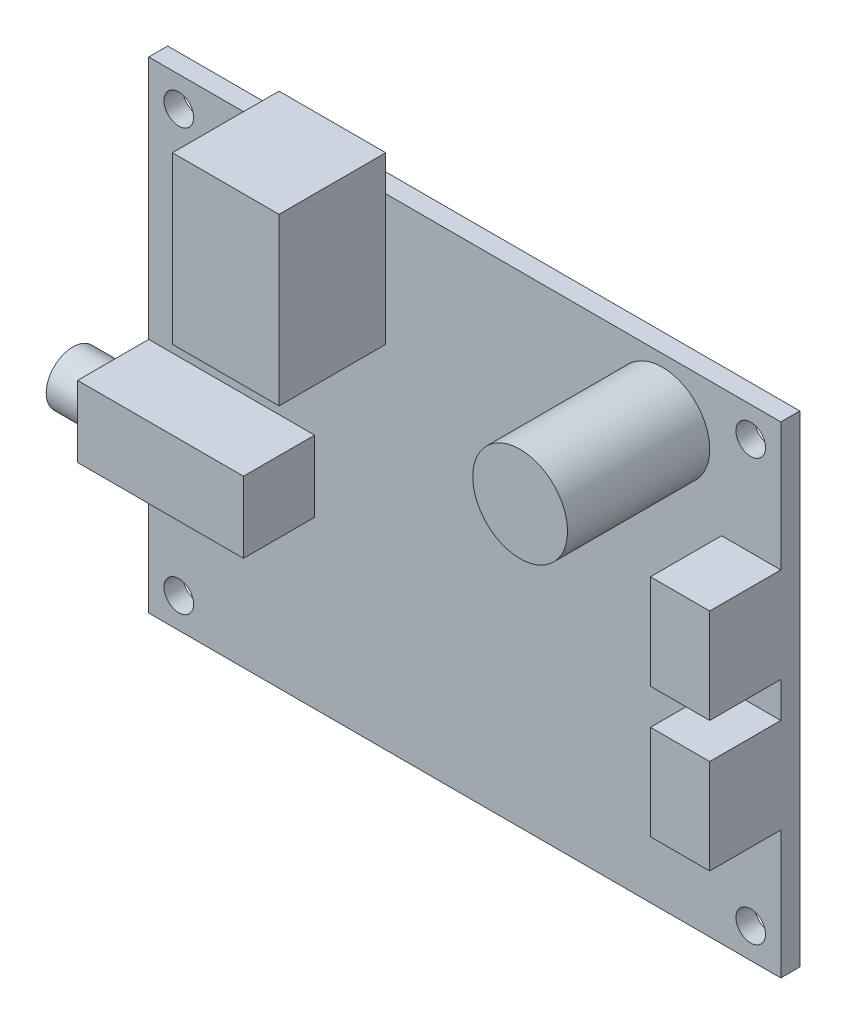
from build123d import *

# Parameters (mm, degrees)
ESQUISSE1_W        = 53.34
ESQUISSE1_H        = 40.64
ESQUISSE1_R        = 1.25
BOSS_EXTRU_1_DEPTH = 1.6
ESQUISSE2_W        = 14
ESQUISSE2_H        = 6
ESQUISSE2_W_2      = 5
ESQUISSE2_H_2      = 8
BOSS_EXTRU_2_DEPTH = 6
ESQUISSE3_R        = 2.25
BOSS_EXTRU_3_DEPTH = 3.4
ESQUISSE4_W        = 9
ESQUISSE4_H        = 14
BOSS_EXTRU_4_DEPTH = 9
ESQUISSE5_R        = 4
BOSS_EXTRU_5_DEPTH = 12


with BuildPart() as part:
    # Esquisse1 → Boss.-Extru.1 (new body)
    with BuildSketch(Plane.XY):
        Rectangle(ESQUISSE1_W, ESQUISSE1_H)
        with Locations((-24.13, 17.78)):
            Circle(ESQUISSE1_R, mode=Mode.SUBTRACT)
        with Locations((24.13, -17.78)):
            Circle(ESQUISSE1_R, mode=Mode.SUBTRACT)
        with Locations((24.13, 17.78)):
            Circle(ESQUISSE1_R, mode=Mode.SUBTRACT)
        with Locations((-24.13, -17.78)):
            Circle(ESQUISSE1_R, mode=Mode.SUBTRACT)
    extrude(amount=BOSS_EXTRU_1_DEPTH)

    # Esquisse2 → Boss.-Extru.2 (add)
    with BuildSketch(Plane.XY.offset(1.6)):
        with Locations((-19.67, -3.32)):
            Rectangle(ESQUISSE2_W, ESQUISSE2_H)
        with Locations((24.17, 5.5)):
            Rectangle(ESQUISSE2_W_2, ESQUISSE2_H_2)
        with Locations((24.17, -5.5)):
            Rectangle(ESQUISSE2_W_2, ESQUISSE2_H_2)
    extrude(amount=BOSS_EXTRU_2_DEPTH)

    # Esquisse3 → Boss.-Extru.3 (add)
    with BuildSketch(Plane.ZY.offset(26.67)):
        with Locations(Location((4.6, -3.32, 0), (0, 0, 270))):
            Circle(ESQUISSE3_R)
    extrude(amount=BOSS_EXTRU_3_DEPTH)

    # Esquisse4 → Boss.-Extru.4 (add)
    with BuildSketch(Plane.XY.offset(1.6)):
        with Locations((-11.17, 16.32)):
            Rectangle(ESQUISSE4_W, ESQUISSE4_H)
    extrude(amount=BOSS_EXTRU_4_DEPTH)

    # Esquisse5 → Boss.-Extru.5 (add)
    with BuildSketch(Plane.XY.offset(1.6)):
        with Locations((16.67, 15.32)):
            Circle(ESQUISSE5_R)
    extrude(amount=BOSS_EXTRU_5_DEPTH)


solid = part.part
